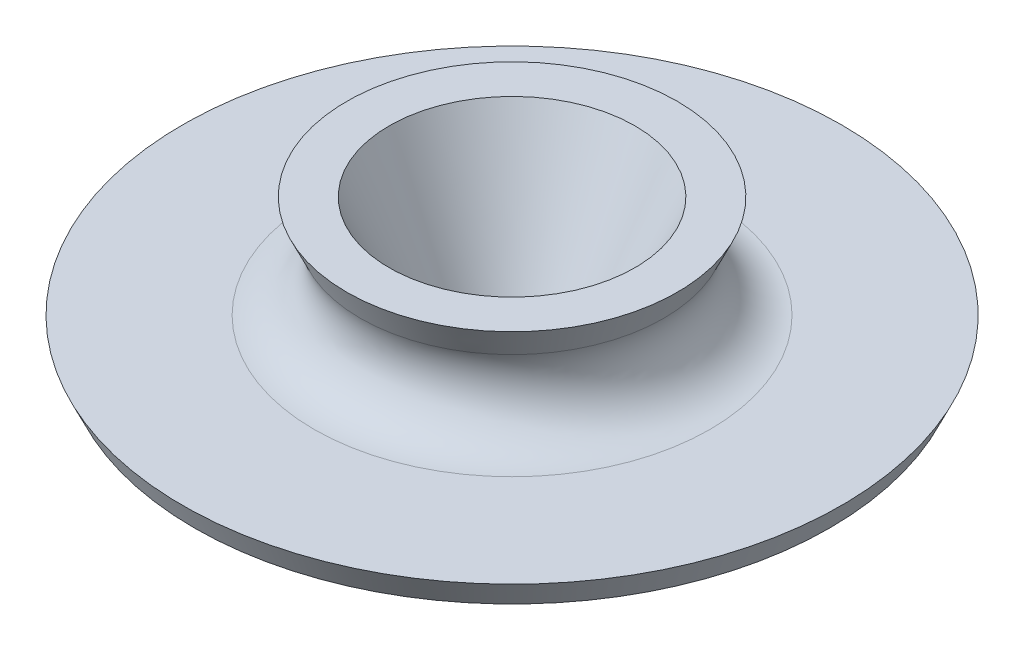
from build123d import *

# Parameters (mm, degrees)
FILLET1_R = 12.7


with BuildPart() as part:
    # Sketch1 → Revolve1 (revolve)
    with BuildSketch(Plane.XY, mode=Mode.PRIVATE) as revolve1_sk:
        Polygon((-12.7, 0), (-19.706449785, 0), (-22.667503415, 6.35), (-78.719101698, 6.35), (-81.680155327, 12.7), (-29.131781937, 12.7), (-40.975996454, 38.1), (-30.466321776, 38.1), align=None)
    revolve(revolve1_sk.sketch.rotate(Axis((0, 0, 0), (0, 1, 0)), 270), axis=Axis((0, 0, 0), (0, 1, 0)))

    # Fillet1
    fillet1_edges = [part.edges().sort_by_distance(p)[0] for p in [
        (0, 12.7, 29.131781937),
    ]]
    fillet(fillet1_edges, radius=FILLET1_R)


solid = part.part
